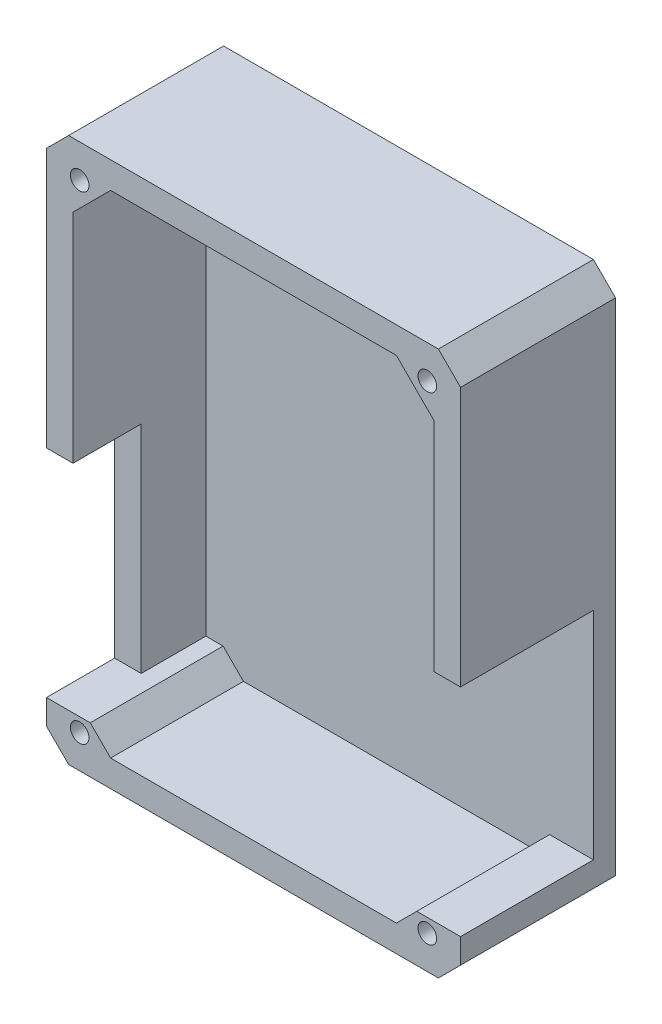
from build123d import *

# Parameters (mm, degrees)
SKETCH1_W           = 93.5
SKETCH1_H           = 123
BOSS_EXTRUDE1_DEPTH = 5
BOSS_EXTRUDE2_DEPTH = 30
CHAMFER1_SIZE       = 5
SKETCH4_W           = 6
SKETCH4_H           = 48.8
BOSS_EXTRUDE3_DEPTH = 14.6
SKETCH5_R           = 2.1
CUT_EXTRUDE1_DEPTH  = 3.5
SKETCH6_R           = 2.1
CUT_EXTRUDE2_DEPTH  = 3.5


with BuildPart() as part:
    # Sketch1 → Boss-Extrude1 (new body)
    with BuildSketch(Plane.XY):
        with Locations((0, 28.5)):
            Rectangle(SKETCH1_W, SKETCH1_H)
    extrude(amount=BOSS_EXTRUDE1_DEPTH)

    # Sketch3 → Boss-Extrude2 (add)
    with BuildSketch(Plane.XY.offset(5)):
        Polygon((-40.75, -22.4), (-46.75, -22.4), (-46.75, -33), (46.75, -33), (46.75, -22.4), (40.75, -22.4), (40.75, -27), (32.264718626, -27), (-32.264718626, -27), (-40.75, -27), align=None)
        Polygon((-36.864718626, -22.4), (-40.75, -22.4), (-40.75, -27), (-32.264718626, -27), align=None)
        Polygon((40.75, -27), (40.75, -22.4), (36.864718626, -22.4), (32.264718626, -27), align=None)
        Polygon((-46.75, 90), (-46.75, 26.4), (-40.75, 26.4), (-40.75, 75.514718626), (-40.75, 84), (-32.264718626, 84), (32.264718626, 84), (40.75, 84), (40.75, 75.514718626), (40.75, 26.4), (46.75, 26.4), (46.75, 90), align=None)
        Polygon((40.75, 84), (32.264718626, 84), (40.75, 75.514718626), align=None)
        Polygon((-40.75, 84), (-40.75, 75.514718626), (-32.264718626, 84), align=None)
    extrude(amount=BOSS_EXTRUDE2_DEPTH)

    # Chamfer1
    chamfer1_edges = [part.edges().sort_by_distance(p)[0] for p in [
        (-46.75, 90, 17.5),
        (46.75, 90, 17.5),
        (46.75, -33, 17.5),
        (-46.75, -33, 17.5),
    ]]
    chamfer(chamfer1_edges, length=CHAMFER1_SIZE)

    # Sketch4 → Boss-Extrude3 (add)
    with BuildSketch(Plane.XY.offset(5)):
        with Locations((-43.75, 2)):
            Rectangle(SKETCH4_W, SKETCH4_H)
    extrude(amount=BOSS_EXTRUDE3_DEPTH)

    # Sketch5 → Cut-Extrude1 (cut)
    with BuildSketch(Plane.XY.offset(35)):
        with Locations((-39.25, 82.5)):
            Circle(SKETCH5_R)
        with Locations(Location((-39.25, -25.5, 0), (0, 0, 180))):
            Circle(SKETCH5_R)
        with Locations(Location((39.25, 82.5, 0), (0, 0, 180))):
            Circle(SKETCH5_R)
        with Locations((39.25, -25.5)):
            Circle(SKETCH5_R)
    extrude(amount=-CUT_EXTRUDE1_DEPTH, mode=Mode.SUBTRACT)

    # Sketch6 → Cut-Extrude2 (cut)
    with BuildSketch(Plane(origin=(0, 0, 0), x_dir=(-1, 0, 0), z_dir=(0, 0, -1))):
        with Locations((-33.307444613, -24)):
            Circle(SKETCH6_R)
        with Locations((-33.307444613, 32)):
            Circle(SKETCH6_R)
        with Locations(Location((33.307444613, 32, 0), (0, 0, 180))):
            Circle(SKETCH6_R)
        with Locations(Location((33.307444613, -24, 0), (0, 0, 180))):
            Circle(SKETCH6_R)
    extrude(amount=-CUT_EXTRUDE2_DEPTH, mode=Mode.SUBTRACT)


solid = part.part
